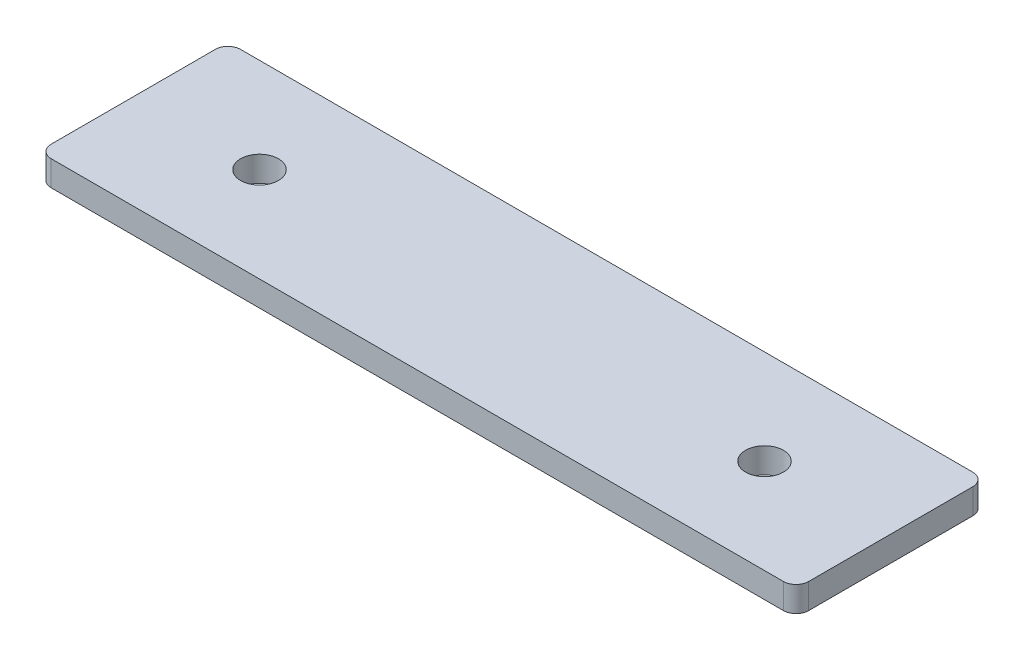
from build123d import *

# Parameters (mm, degrees)
SKETCH1_W           = 60
SKETCH1_H           = 15
SKETCH1_R           = 1.5
BOSS_EXTRUDE1_DEPTH = 2
FILLET1_R           = 1


with BuildPart() as part:
    # Sketch1 → Boss-Extrude1 (new body)
    with BuildSketch(Plane(origin=(0, 0, 0), x_dir=(1, 0, 0), z_dir=(0, 1, 0))):
        with Locations((30, 7.5)):
            Rectangle(SKETCH1_W, SKETCH1_H)
        with Locations(Location((50, 7.5, 0), (0, 0, 270))):
            Circle(SKETCH1_R, mode=Mode.SUBTRACT)
        with Locations(Location((10, 7.5, 0), (0, 0, 270))):
            Circle(SKETCH1_R, mode=Mode.SUBTRACT)
    extrude(amount=BOSS_EXTRUDE1_DEPTH)

    # Fillet1
    fillet1_edges = [part.edges().sort_by_distance(p)[0] for p in [
        (0, 1, 0),
        (0, 1, -15),
        (60, 1, -15),
        (60, 1, 0),
    ]]
    fillet(fillet1_edges, radius=FILLET1_R)


solid = part.part
